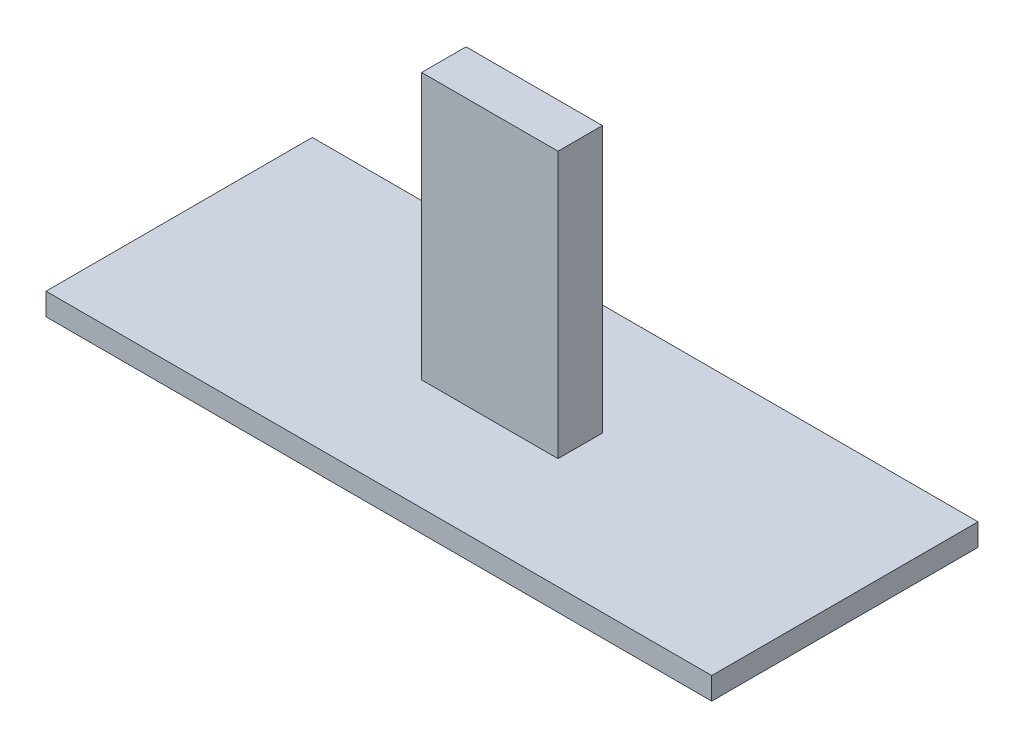
from build123d import *

# Parameters (mm, degrees)
SKETCH_1_W      = 150
SKETCH_1_H      = 60
EXTRUDE_1_DEPTH = 5
SKETCH_2_W      = 30.723972916
SKETCH_2_H      = 10
EXTRUDE_2_DEPTH = 60


with BuildPart() as part:
    # 草图1 → 凸台-拉伸1 (new body)
    with BuildSketch(Plane(origin=(0, 0, 0), x_dir=(1, 0, 0), z_dir=(0, 1, 0))):
        with Locations((-43.668678378, 30)):
            Rectangle(SKETCH_1_W, SKETCH_1_H)
    extrude(amount=EXTRUDE_1_DEPTH)

    # 草图2 → 凸台-拉伸2 (add)
    with BuildSketch(Plane(origin=(0, 5, 0), x_dir=(1, 0, 0), z_dir=(0, 1, 0))):
        with Locations((-43.668678378, 30)):
            Rectangle(SKETCH_2_W, SKETCH_2_H)
    extrude(amount=EXTRUDE_2_DEPTH)


solid = part.part
